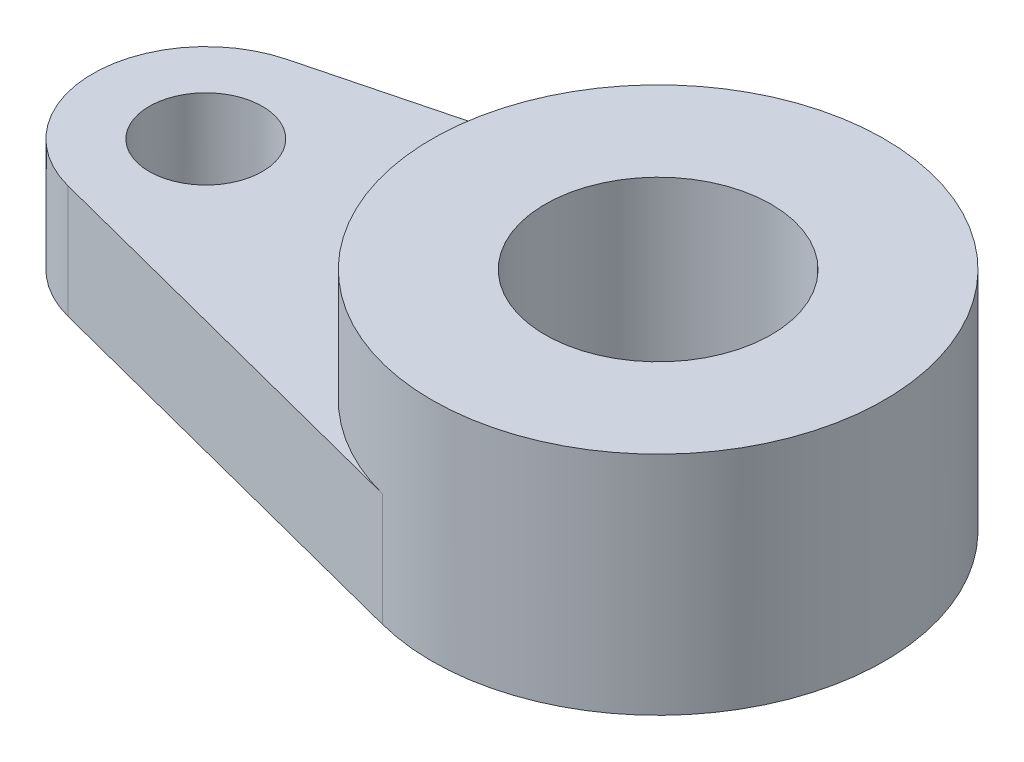
from build123d import *

# Parameters (mm, degrees)
BOSS_EXTRUDE1_DEPTH = 6
BOSS_EXTRUDE2_DEPTH = 3
SKETCH2_R           = 3
SKETCH2_R_2         = 1.5
CUT_EXTRUDE1_DEPTH  = 18.23368794


with BuildPart() as part:
    # Sketch1 → Boss-Extrude1 (new body)
    with BuildSketch(Plane(origin=(0, 0, 0), x_dir=(1, 0, 0), z_dir=(0, 1, 0))):
        with BuildLine():
            ThreePointArc((6, 0), (3.674234614, 4.74341649), (-1.5, 5.809475019))
            ThreePointArc((-1.5, 5.809475019), (-6, 0), (-1.5, -5.809475019))
            ThreePointArc((-1.5, -5.809475019), (3.674234614, -4.74341649), (6, 0))
        make_face()
    extrude(amount=BOSS_EXTRUDE1_DEPTH)

    # Sketch1<3> → Boss-Extrude2 (add)
    with BuildSketch(Plane(origin=(0, 0, 0), x_dir=(1, 0, 0), z_dir=(0, 1, 0))):
        with BuildLine():
            Line((-1.5, 5.809475019), (-12.75, 2.90473751))
            ThreePointArc((-12.75, 2.90473751), (-15, 0), (-12.75, -2.90473751))
            Line((-12.75, -2.90473751), (-1.5, -5.809475019))
            ThreePointArc((-1.5, -5.809475019), (-6, 0), (-1.5, 5.809475019))
        make_face()
    extrude(amount=BOSS_EXTRUDE2_DEPTH)

    # Sketch2 → Cut-Extrude1 (cut, through all)
    with BuildSketch(Plane.XZ.offset(-6)):
        Circle(SKETCH2_R)
        with Locations((-12, 0)):
            Circle(SKETCH2_R_2)
    extrude(amount=CUT_EXTRUDE1_DEPTH, mode=Mode.SUBTRACT)


solid = part.part
